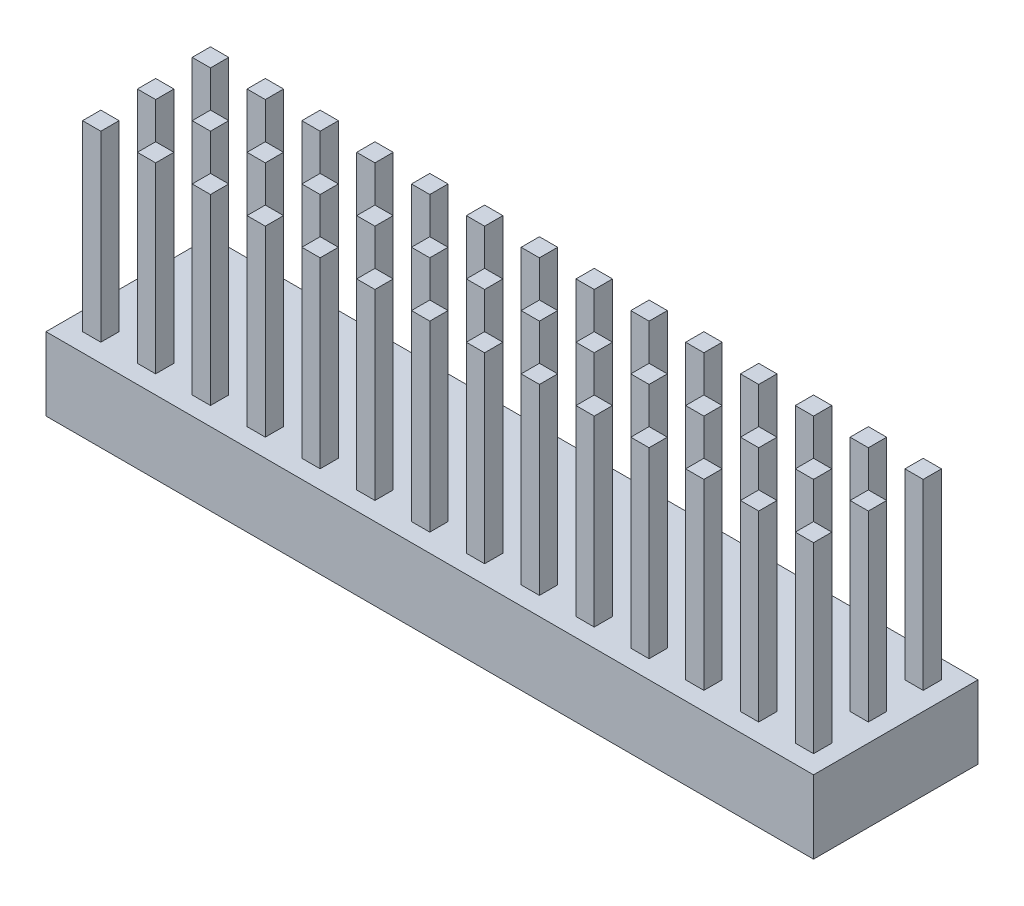
from build123d import *

# Parameters (mm, degrees)
SKETCH1_W      = 32.004
SKETCH1_H      = 6.858
EXTRUDE1_DEPTH = 3.048
SKETCH2_W      = 0.762
SKETCH2_H      = 0.762
EXTRUDE2_DEPTH = 7.62


with BuildPart() as part:
    # Sketch1 → Extrude1 (new body)
    with BuildSketch(Plane(origin=(0, 0, 0), x_dir=(1, 0, 0), z_dir=(0, 1, 0))):
        with Locations((16.002, 3.429)):
            Rectangle(SKETCH1_W, SKETCH1_H)
    extrude(amount=EXTRUDE1_DEPTH)

    # Sketch2 → Extrude2 (add)
    with BuildSketch(Plane(origin=(0, 3.048, 0), x_dir=(1, 0, 0), z_dir=(0, 1, 0))):
        with Locations((3.429, 5.715)):
            Rectangle(SKETCH2_W, SKETCH2_H)
        with Locations((1.143, 5.715)):
            Rectangle(SKETCH2_W, SKETCH2_H)
        with Locations((5.715, 5.715)):
            Rectangle(SKETCH2_W, SKETCH2_H)
        with Locations((8.001, 5.715)):
            Rectangle(SKETCH2_W, SKETCH2_H)
        with Locations((10.287, 5.715)):
            Rectangle(SKETCH2_W, SKETCH2_H)
        with Locations((12.573, 5.715)):
            Rectangle(SKETCH2_W, SKETCH2_H)
        with Locations((14.859, 5.715)):
            Rectangle(SKETCH2_W, SKETCH2_H)
        with Locations((17.145, 5.715)):
            Rectangle(SKETCH2_W, SKETCH2_H)
        with Locations((19.431, 5.715)):
            Rectangle(SKETCH2_W, SKETCH2_H)
        with Locations((21.717, 5.715)):
            Rectangle(SKETCH2_W, SKETCH2_H)
        with Locations((24.003, 5.715)):
            Rectangle(SKETCH2_W, SKETCH2_H)
        with Locations((26.289, 5.715)):
            Rectangle(SKETCH2_W, SKETCH2_H)
        with Locations((28.575, 5.715)):
            Rectangle(SKETCH2_W, SKETCH2_H)
        with Locations((30.861, 5.715)):
            Rectangle(SKETCH2_W, SKETCH2_H)
        with Locations((1.143, 3.429)):
            Rectangle(SKETCH2_W, SKETCH2_H)
        with Locations((3.429, 3.429)):
            Rectangle(SKETCH2_W, SKETCH2_H)
        with Locations((5.715, 3.429)):
            Rectangle(SKETCH2_W, SKETCH2_H)
        with Locations((8.001, 3.429)):
            Rectangle(SKETCH2_W, SKETCH2_H)
        with Locations((10.287, 3.429)):
            Rectangle(SKETCH2_W, SKETCH2_H)
        with Locations((12.573, 3.429)):
            Rectangle(SKETCH2_W, SKETCH2_H)
        with Locations((14.859, 3.429)):
            Rectangle(SKETCH2_W, SKETCH2_H)
        with Locations((17.145, 3.429)):
            Rectangle(SKETCH2_W, SKETCH2_H)
        with Locations((19.431, 3.429)):
            Rectangle(SKETCH2_W, SKETCH2_H)
        with Locations((21.717, 3.429)):
            Rectangle(SKETCH2_W, SKETCH2_H)
        with Locations((24.003, 3.429)):
            Rectangle(SKETCH2_W, SKETCH2_H)
        with Locations((26.289, 3.429)):
            Rectangle(SKETCH2_W, SKETCH2_H)
        with Locations((28.575, 3.429)):
            Rectangle(SKETCH2_W, SKETCH2_H)
        with Locations((30.861, 3.429)):
            Rectangle(SKETCH2_W, SKETCH2_H)
        with Locations((1.143, 1.143)):
            Rectangle(SKETCH2_W, SKETCH2_H)
        with Locations((3.429, 1.143)):
            Rectangle(SKETCH2_W, SKETCH2_H)
        with Locations((5.715, 1.143)):
            Rectangle(SKETCH2_W, SKETCH2_H)
        with Locations((8.001, 1.143)):
            Rectangle(SKETCH2_W, SKETCH2_H)
        with Locations((10.287, 1.143)):
            Rectangle(SKETCH2_W, SKETCH2_H)
        with Locations((12.573, 1.143)):
            Rectangle(SKETCH2_W, SKETCH2_H)
        with Locations((14.859, 1.143)):
            Rectangle(SKETCH2_W, SKETCH2_H)
        with Locations((17.145, 1.143)):
            Rectangle(SKETCH2_W, SKETCH2_H)
        with Locations((19.431, 1.143)):
            Rectangle(SKETCH2_W, SKETCH2_H)
        with Locations((21.717, 1.143)):
            Rectangle(SKETCH2_W, SKETCH2_H)
        with Locations((24.003, 1.143)):
            Rectangle(SKETCH2_W, SKETCH2_H)
        with Locations((26.289, 1.143)):
            Rectangle(SKETCH2_W, SKETCH2_H)
        with Locations((28.575, 1.143)):
            Rectangle(SKETCH2_W, SKETCH2_H)
        with Locations((30.861, 1.143)):
            Rectangle(SKETCH2_W, SKETCH2_H)
    extrude(amount=EXTRUDE2_DEPTH)


solid = part.part
